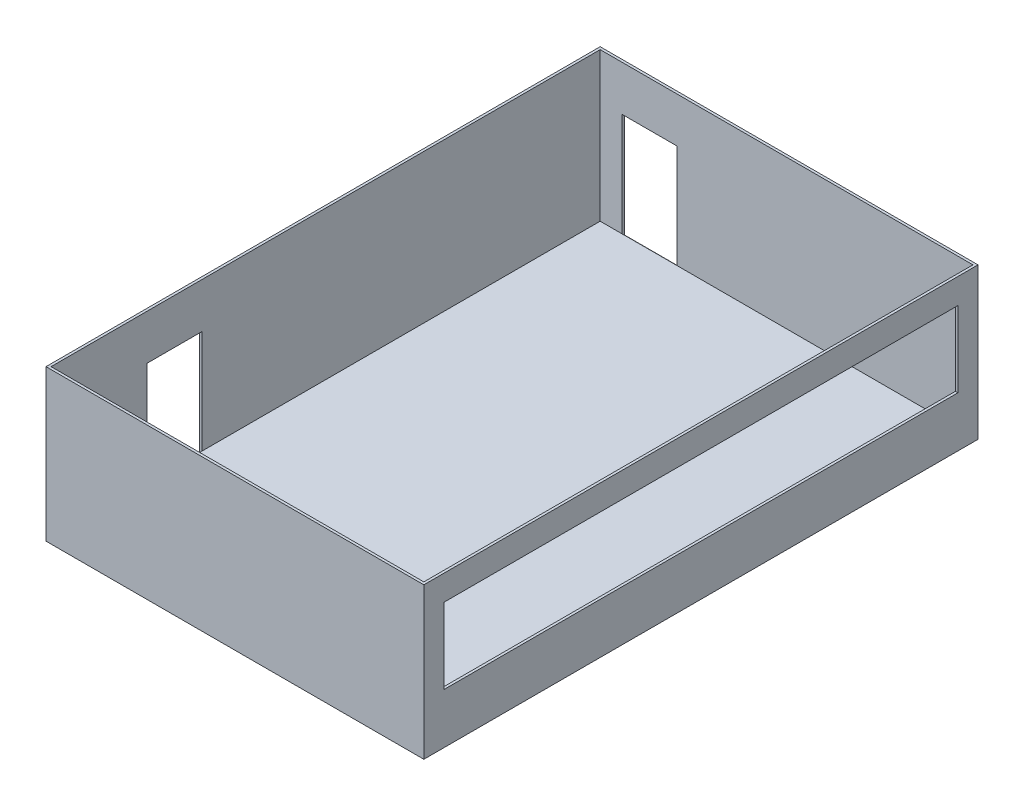
from build123d import *

# Parameters (mm, degrees)
SKETCH3_W           = 7500
SKETCH3_H           = 11000
BOSS_EXTRUDE1_DEPTH = 3000
SHELL1_T            = -50
CUT_EXTRUDE1_REACH  = 9774.41
SKETCH4_W           = 5100
SKETCH4_H           = 1500
SKETCH5_W           = 1100
SKETCH5_H           = 2100
CUT_EXTRUDE2_DEPTH  = 50
SKETCH6_W           = 1100
SKETCH6_H           = 2100
CUT_EXTRUDE3_DEPTH  = 50


with BuildPart() as part:
    # Sketch3 → Boss-Extrude1 (new body)
    with BuildSketch(Plane(origin=(0, 0, 0), x_dir=(1, 0, 0), z_dir=(0, 1, 0))):
        Rectangle(SKETCH3_W, SKETCH3_H)
    extrude(amount=BOSS_EXTRUDE1_DEPTH)

    # Shell1
    shell1_openings = [part.faces().sort_by_distance(p)[0] for p in [
        (0, 3000, 0),
    ]]
    offset(amount=SHELL1_T, openings=shell1_openings, kind=Kind.INTERSECTION)

    # Sketch4 → Cut-Extrude1 (cut, up to next)
    with BuildSketch(Plane(origin=(3750, 0, 0), x_dir=(0, 0, -1), z_dir=(1, 0, 0)), mode=Mode.PRIVATE) as cut_extrude1_sk1:
        with Locations((-2550, 1750)):
            Rectangle(SKETCH4_W, SKETCH4_H)
    cut_extrude1_tool1 = extrude(cut_extrude1_sk1.sketch, amount=-CUT_EXTRUDE1_REACH, mode=Mode.PRIVATE) & part.part
    # Sketch4 → Cut-Extrude1 (cut, up to next)
    with BuildSketch(Plane(origin=(3750, 0, 0), x_dir=(0, 0, -1), z_dir=(1, 0, 0)), mode=Mode.PRIVATE) as cut_extrude1_sk2:
        with Locations((2550, 1750)):
            Rectangle(SKETCH4_W, SKETCH4_H)
    cut_extrude1_tool2 = extrude(cut_extrude1_sk2.sketch, amount=-CUT_EXTRUDE1_REACH, mode=Mode.PRIVATE) & part.part
    add(cut_extrude1_tool1.solids().sort_by_distance((3750, 1750, 2550))[0], mode=Mode.SUBTRACT)
    add(cut_extrude1_tool2.solids().sort_by_distance((3750, 1750, -2550))[0], mode=Mode.SUBTRACT)

    # Sketch5 → Cut-Extrude2 (cut)
    with BuildSketch(Plane(origin=(0, 0, -5500), x_dir=(-1, 0, 0), z_dir=(0, 0, -1))):
        with Locations((2720, 1055)):
            Rectangle(SKETCH5_W, SKETCH5_H)
    extrude(amount=-CUT_EXTRUDE2_DEPTH, mode=Mode.SUBTRACT)

    # Sketch6 → Cut-Extrude3 (cut)
    with BuildSketch(Plane.ZY.offset(3750)):
        with Locations((3000, 1055)):
            Rectangle(SKETCH6_W, SKETCH6_H)
    extrude(amount=-CUT_EXTRUDE3_DEPTH, mode=Mode.SUBTRACT)


solid = part.part
